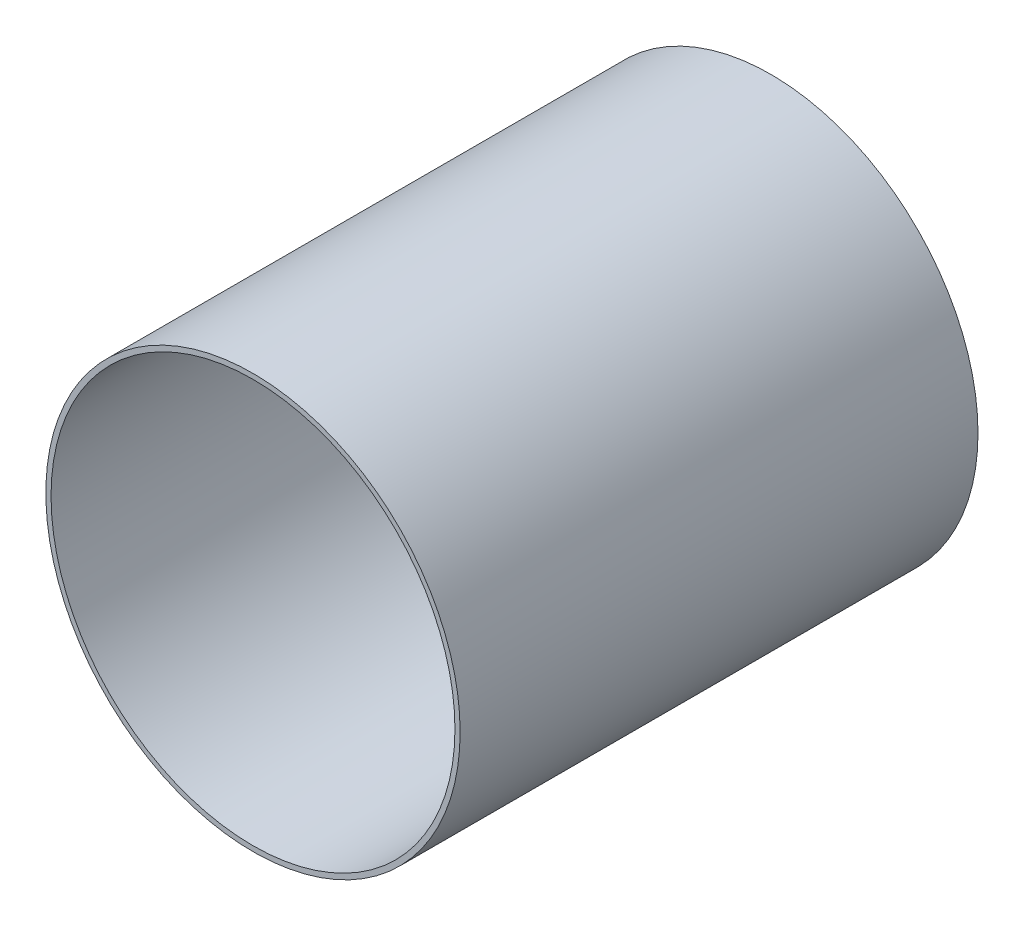
from build123d import *

# Parameters (mm, degrees)
SKETCH1_R           = 101.6
BOSS_EXTRUDE1_DEPTH = 254
SHELL1_T            = -2.54
SKETCH2_R           = 12.7
CUT_EXTRUDE1_DEPTH  = 254


with BuildPart() as part:
    # Sketch1 → Boss-Extrude1 (new body)
    with BuildSketch(Plane.XY):
        Circle(SKETCH1_R)
    extrude(amount=BOSS_EXTRUDE1_DEPTH)

    # Shell1
    shell1_openings = [part.faces().sort_by_distance(p)[0] for p in [
        (0, 0, 254),
    ]]
    offset(amount=SHELL1_T, openings=shell1_openings, kind=Kind.INTERSECTION)

    # Sketch2 → Cut-Extrude1 (cut)
    with BuildSketch(Plane.XY.offset(2.54)):
        Circle(SKETCH2_R)
    extrude(amount=-CUT_EXTRUDE1_DEPTH, mode=Mode.SUBTRACT)


solid = part.part
